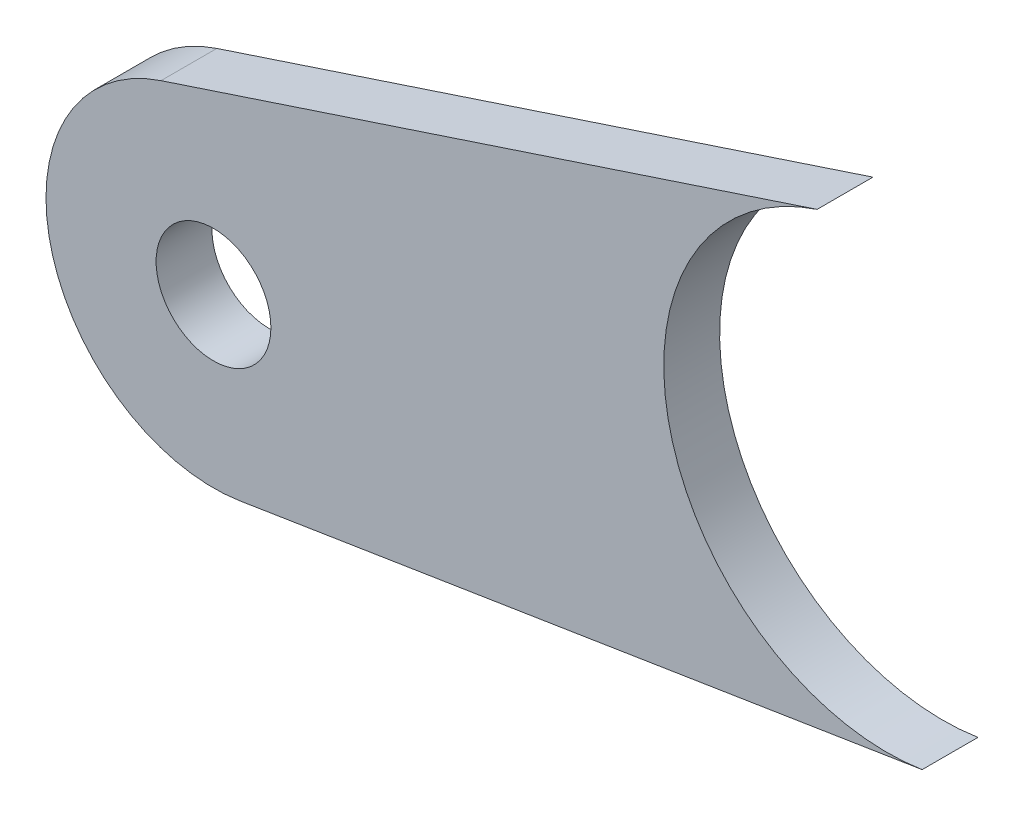
from build123d import *

# Parameters (mm, degrees)
SKETCH1_R           = 3.2639
BOSS_EXTRUDE1_DEPTH = 3.175


with BuildPart() as part:
    # Sketch1 → Boss-Extrude1 (new body)
    with BuildSketch(Plane.XY):
        with BuildLine():
            ThreePointArc((141.861604691, -3.242247502), (127.5274593, 6.303904573), (135.888002747, 21.360400075))
            Line((135.888002747, 21.360400075), (98.578779095, 9.044968433))
            ThreePointArc((98.578779095, 9.044968433), (92.30837151, -2.247403193), (103.058980553, -9.40701725))
            Line((103.058980553, -9.40701725), (141.861604691, -3.242247502))
        make_face()
        with Locations((101.56444, 0)):
            Circle(SKETCH1_R, mode=Mode.SUBTRACT)
    extrude(amount=BOSS_EXTRUDE1_DEPTH)


solid = part.part
